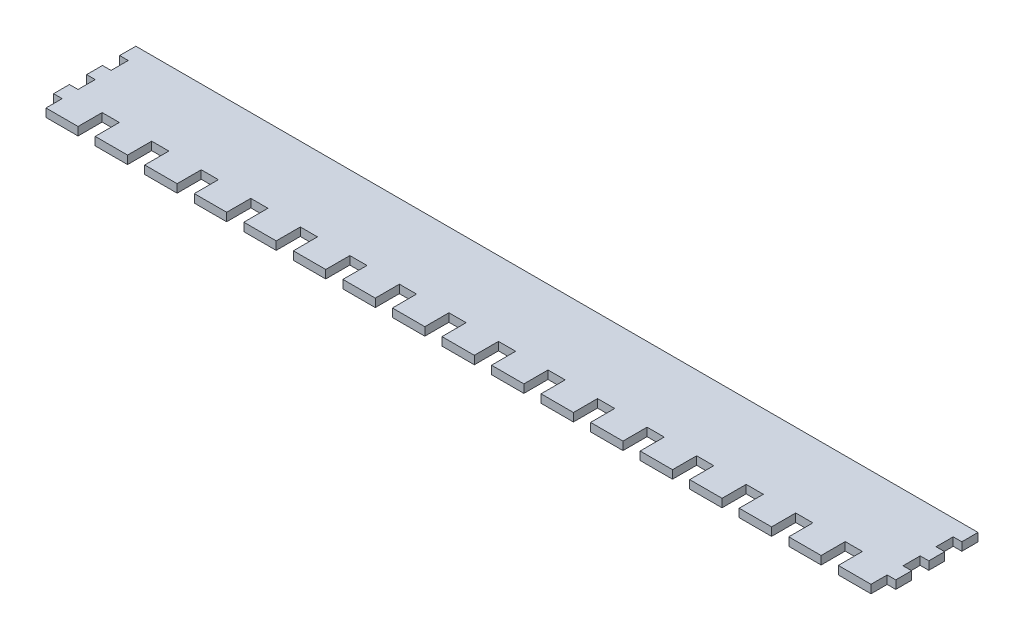
from build123d import *

# Parameters (mm, degrees)
SKETCH1_W           = 647.7
SKETCH1_H           = 57.15
BOSS_EXTRUDE1_DEPTH = 6.35
SKETCH3_W           = 24.892
SKETCH3_H           = 18.542
BOSS_EXTRUDE2_DEPTH = 6.35
SKETCH4_W           = 13.208
SKETCH4_H           = 13.208
CUT_EXTRUDE2_DEPTH  = 328.321182769


with BuildPart() as part:
    # Sketch1 → Boss-Extrude1 (new body)
    with BuildSketch(Plane(origin=(0, 0, 0), x_dir=(1, 0, 0), z_dir=(0, 1, 0))):
        Rectangle(SKETCH1_W, SKETCH1_H)
    extrude(amount=BOSS_EXTRUDE1_DEPTH)

    # Sketch3 → Boss-Extrude2 (add)
    with BuildSketch(Plane(origin=(0, 0, 0), x_dir=(1, 0, 0), z_dir=(0, 1, 0))):
        Polygon((-317.5, -47.117), (-292.608, -47.117), (-292.608, -28.575), (-317.5, -28.575), (-323.85, -28.575), (-323.85, -47.117), align=None)
        with Locations((-266.954, -37.846)):
            Rectangle(SKETCH3_W, SKETCH3_H)
        with Locations((-228.854, -37.846)):
            Rectangle(SKETCH3_W, SKETCH3_H)
        with Locations((-190.754, -37.846)):
            Rectangle(SKETCH3_W, SKETCH3_H)
        with Locations((-152.654, -37.846)):
            Rectangle(SKETCH3_W, SKETCH3_H)
        with Locations((-114.554, -37.846)):
            Rectangle(SKETCH3_W, SKETCH3_H)
        with Locations((-76.454, -37.846)):
            Rectangle(SKETCH3_W, SKETCH3_H)
        with Locations((-38.354, -37.846)):
            Rectangle(SKETCH3_W, SKETCH3_H)
        with Locations((-0.254, -37.846)):
            Rectangle(SKETCH3_W, SKETCH3_H)
        with Locations((37.846, -37.846)):
            Rectangle(SKETCH3_W, SKETCH3_H)
        with Locations((75.946, -37.846)):
            Rectangle(SKETCH3_W, SKETCH3_H)
        with Locations((114.046, -37.846)):
            Rectangle(SKETCH3_W, SKETCH3_H)
        with Locations((152.146, -37.846)):
            Rectangle(SKETCH3_W, SKETCH3_H)
        with Locations((190.246, -37.846)):
            Rectangle(SKETCH3_W, SKETCH3_H)
        with Locations((228.346, -37.846)):
            Rectangle(SKETCH3_W, SKETCH3_H)
        with Locations((266.446, -37.846)):
            Rectangle(SKETCH3_W, SKETCH3_H)
        Polygon((316.992, -28.575), (292.1, -28.575), (292.1, -47.117), (316.992, -47.117), (323.85, -47.117), (323.85, -28.575), align=None)
    extrude(amount=BOSS_EXTRUDE2_DEPTH)

    # Sketch4 → Cut-Extrude2 (cut, through all)
    with BuildSketch(Plane(origin=(0, 0, 0), x_dir=(1, 0, 0), z_dir=(0, 1, 0))):
        with Locations((-323.85, 9.525)):
            Rectangle(SKETCH4_W, SKETCH4_H)
        with Locations((-323.85, -15.875)):
            Rectangle(SKETCH4_W, SKETCH4_H)
        with Locations((323.85, -15.875)):
            Rectangle(SKETCH4_W, SKETCH4_H)
        with Locations((323.85, 9.525)):
            Rectangle(SKETCH4_W, SKETCH4_H)
        with Locations((-323.85, -41.275)):
            Rectangle(SKETCH4_W, SKETCH4_H)
        with Locations((323.85, -41.275)):
            Rectangle(SKETCH4_W, SKETCH4_H)
    extrude(amount=CUT_EXTRUDE2_DEPTH, mode=Mode.SUBTRACT)


solid = part.part
